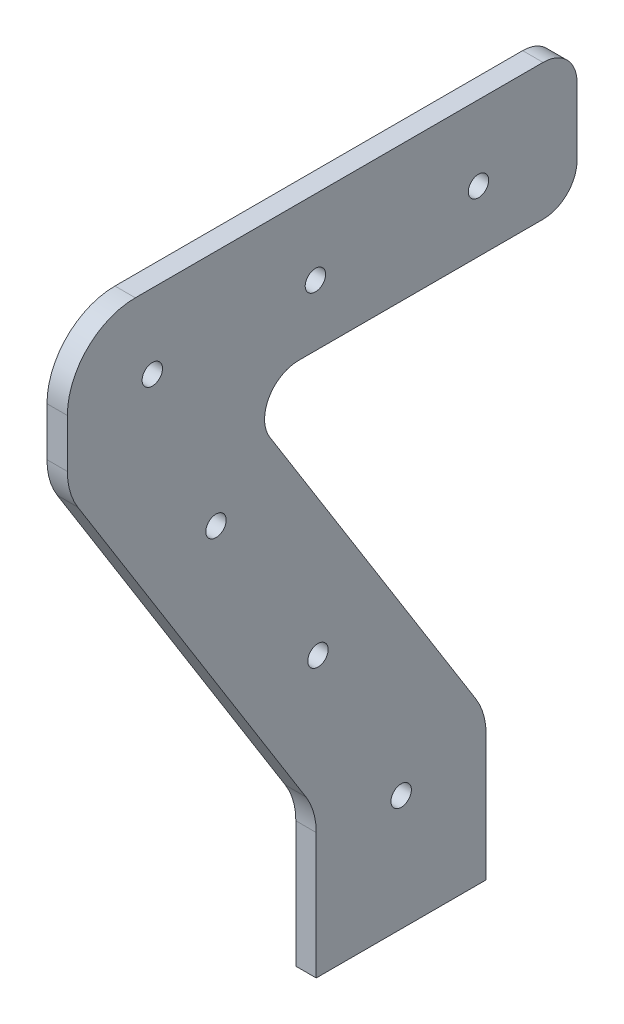
from build123d import *

# Parameters (mm, degrees)
CROQUIS1_W              = 75
CROQUIS1_H              = 100
SALIENTE_EXTRUIR1_DEPTH = 3
CORTAR_EXTRUIR1_DEPTH   = 3
REDONDEO1_R             = 10
REDONDEO3_R             = 5
CROQUIS3_R              = 1.5
CORTAR_EXTRUIR2_DEPTH   = 3


with BuildPart() as part:
    # Croquis1 → Saliente-Extruir1 (new body)
    with BuildSketch(Plane(origin=(0, 0, 0), x_dir=(0, 0, -1), z_dir=(1, 0, 0))):
        with Locations((37.5, -50)):
            Rectangle(CROQUIS1_W, CROQUIS1_H)
    extrude(amount=SALIENTE_EXTRUIR1_DEPTH)

    # Croquis2 → Cortar-Extruir1 (cut)
    with BuildSketch(Plane(origin=(3, 0, 0), x_dir=(0, 0, -1), z_dir=(1, 0, 0))):
        Polygon((75, -20), (25, -20), (61.621978753, -78.595166005), (61.621978753, -100), (75, -100), align=None)
        Polygon((0, -100), (36.621978753, -100), (36.621978753, -78.595166005), (0, -20), align=None)
    extrude(amount=-CORTAR_EXTRUIR1_DEPTH, mode=Mode.SUBTRACT)

    # Redondeo1
    redondeo1_edges = [part.edges().sort_by_distance(p)[0] for p in [
        (1.5, -78.595166005, -61.621978753),
        (1.5, -20, 0),
        (1.5, -78.595166005, -36.621978753),
        (1.5, 0, 0),
    ]]
    fillet(redondeo1_edges, radius=REDONDEO1_R)

    # Redondeo3
    redondeo3_edges = [part.edges().sort_by_distance(p)[0] for p in [
        (1.5, -20, -25),
        (1.5, -20, -75),
        (1.5, 0, -75),
    ]]
    fillet(redondeo3_edges, radius=REDONDEO3_R)

    # Croquis3 → Cortar-Extruir2 (cut)
    with BuildSketch(Plane(origin=(3, 0, 0), x_dir=(0, 0, -1), z_dir=(1, 0, 0))):
        with Locations((12.5, -11)):
            Circle(CROQUIS3_R)
        with Locations((12.5, -83)):
            Circle(CROQUIS3_R)
        with Locations((36.5, -11)):
            Circle(CROQUIS3_R)
        with Locations((60.5, -11)):
            Circle(CROQUIS3_R)
        with Locations((21.875, -35)):
            Circle(CROQUIS3_R)
        with Locations((36.875, -59)):
            Circle(CROQUIS3_R)
        with Locations((49.121978753, -83)):
            Circle(CROQUIS3_R)
    extrude(amount=-CORTAR_EXTRUIR2_DEPTH, mode=Mode.SUBTRACT)


solid = part.part
